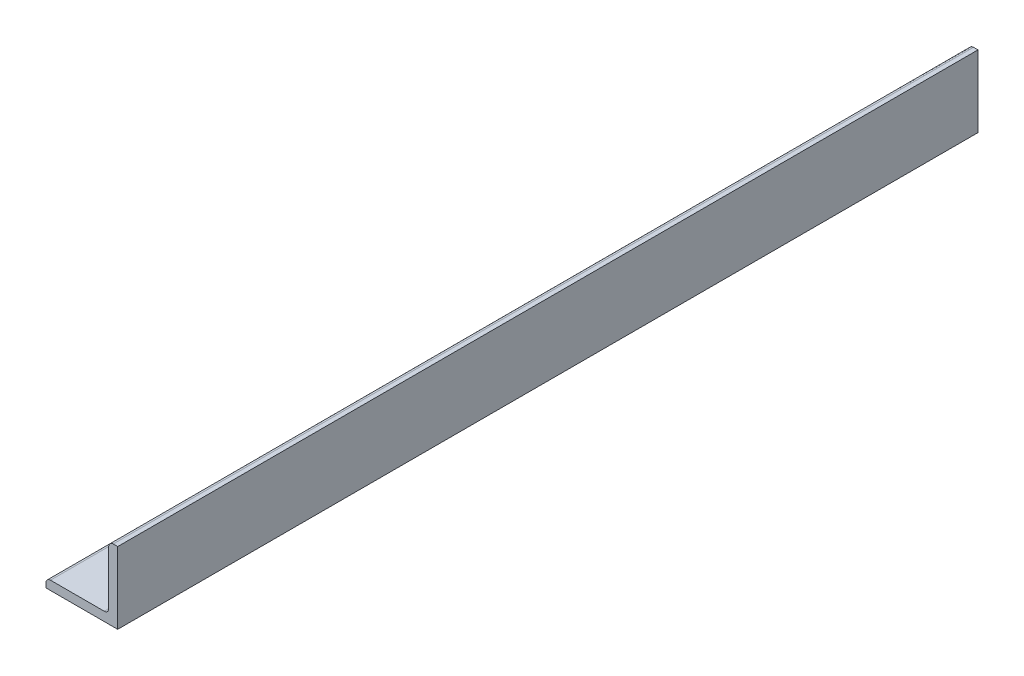
from build123d import *

# Parameters (mm, degrees)
BOSS_EXTRUDE1_DEPTH = 152.4


with BuildPart() as part:
    # Sketch2 → Boss-Extrude1 (new, symmetric)
    with BuildSketch(Plane.XY):
        with BuildLine():
            Line((-12.7, 0), (12.7, 0))
            Line((12.7, 0), (12.7, 25.4))
            Line((12.7, 25.4), (11.1125, 25.4))
            ThreePointArc((11.1125, 25.4), (9.989967985, 24.935032015), (9.525, 23.8125))
            Line((9.525, 23.8125), (9.525, 4.7625))
            ThreePointArc((9.525, 4.7625), (9.060032015, 3.639967985), (7.9375, 3.175))
            Line((7.9375, 3.175), (-11.1125, 3.175))
            ThreePointArc((-11.1125, 3.175), (-12.235032015, 2.710032015), (-12.7, 1.5875))
            Line((-12.7, 1.5875), (-12.7, 0))
        make_face()
    extrude(amount=BOSS_EXTRUDE1_DEPTH, both=True)


solid = part.part
